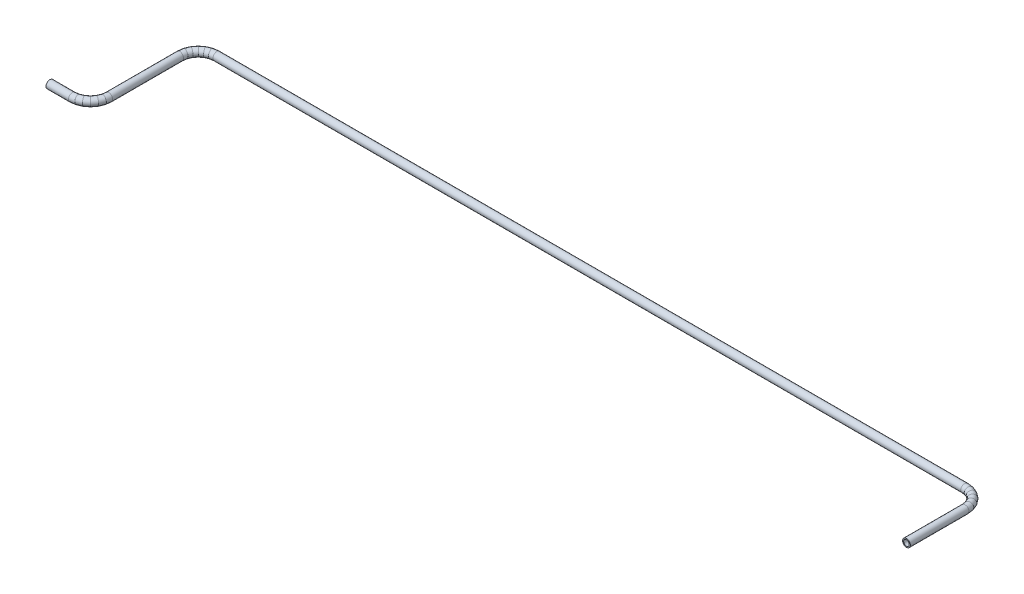
from build123d import *

# Parameters (mm, degrees)
PROFILE_R   = 3.175
PROFILE_R_2 = 2.286


with BuildPart() as part:
    # Tube: sweep along a curve in space
    with BuildLine() as tube_path:
        Line((-3585.892778381, 0, 0), (-3567.692778381, 0, 0))
        Line((-3567.692778381, 0, 0), (-3563.810492704, 0, -0.511112606))
        Line((-3563.810492704, 0, -0.511112606), (-3560.192778381, 0, -2.009618943))
        Line((-3560.192778381, 0, -2.009618943), (-3557.086176663, 0, -4.393398282))
        Line((-3557.086176663, 0, -4.393398282), (-3554.702397324, 0, -7.5))
        Line((-3554.702397324, 0, -7.5), (-3553.203890986, 0, -11.117714323))
        Line((-3553.203890986, 0, -11.117714323), (-3552.692778381, 0, -15))
        Line((-3552.692778381, 0, -15), (-3552.692778381, 0, -73))
        Line((-3552.692778381, 0, -73), (-3552.181665775, 0, -76.882285677))
        Line((-3552.181665775, 0, -76.882285677), (-3550.683159438, 0, -80.5))
        Line((-3550.683159438, 0, -80.5), (-3548.299380099, 0, -83.606601718))
        Line((-3548.299380099, 0, -83.606601718), (-3545.192778381, 0, -85.990381057))
        Line((-3545.192778381, 0, -85.990381057), (-3541.575064057, 0, -87.488887394))
        Line((-3541.575064057, 0, -87.488887394), (-3537.692778381, 0, -88))
        Line((-3537.692778381, 0, -88), (-2926.592778381, 0, -88))
        Line((-2926.592778381, 0, -88), (-2922.710492704, 0, -87.488887394))
        Line((-2922.710492704, 0, -87.488887394), (-2919.092778381, 0, -85.990381057))
        Line((-2919.092778381, 0, -85.990381057), (-2915.986176663, 0, -83.606601718))
        Line((-2915.986176663, 0, -83.606601718), (-2913.602397324, 0, -80.5))
        Line((-2913.602397324, 0, -80.5), (-2912.103890986, 0, -76.882285677))
        Line((-2912.103890986, 0, -76.882285677), (-2911.592778381, 0, -73))
        Line((-2911.592778381, 0, -73), (-2911.592778381, 0, -25.3))
    # Profile → Tube (sweep)
    with BuildSketch(Plane(origin=(-3585.892778381, 0, 0), x_dir=(0, 0, -1), z_dir=(1, 0, 0))):
        Circle(PROFILE_R)
        Circle(PROFILE_R_2, mode=Mode.SUBTRACT)
    sweep(path=tube_path.line, transition=Transition.RIGHT)


solid = part.part
